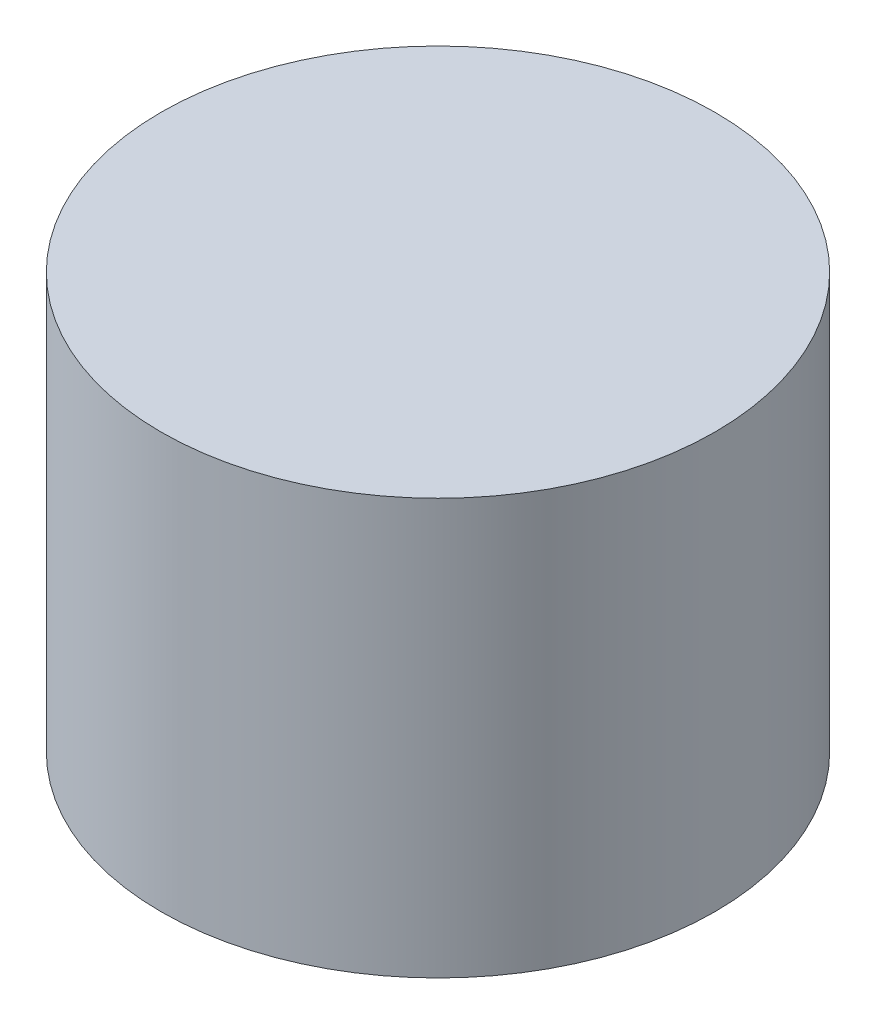
from build123d import *

# Parameters (mm, degrees)
SKETCH1_R           = 10
BOSS_EXTRUDE1_DEPTH = 7.5
SKETCH2_R           = 2
CUT_EXTRUDE1_DEPTH  = 10


with BuildPart() as part:
    # Sketch1 → Boss-Extrude1 (new, symmetric)
    with BuildSketch(Plane(origin=(0, 0, 0), x_dir=(1, 0, 0), z_dir=(0, 1, 0))):
        with Locations(Location((0, 0, 0), (0, 0, 270))):
            Circle(SKETCH1_R)
    extrude(amount=BOSS_EXTRUDE1_DEPTH, both=True)

    # Sketch2 → Cut-Extrude1 (cut)
    with BuildSketch(Plane.XZ.offset(7.5)):
        with Locations(Location((0, 0, 0), (0, 0, 270))):
            Circle(SKETCH2_R)
    extrude(amount=-CUT_EXTRUDE1_DEPTH, mode=Mode.SUBTRACT)


solid = part.part
